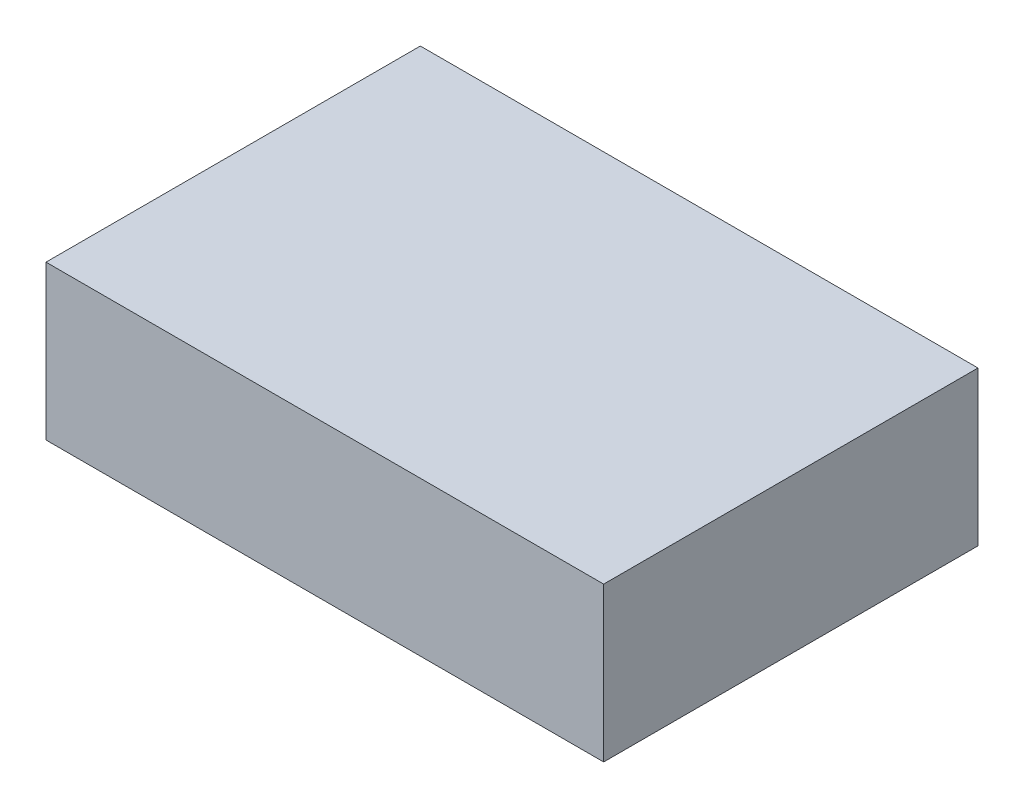
from build123d import *

# Parameters (mm, degrees)
SKETCH1_W           = 36.2
SKETCH1_H           = 24.3
BOSS_EXTRUDE1_DEPTH = 10


with BuildPart() as part:
    # Sketch1 → Boss-Extrude1 (new body)
    with BuildSketch(Plane(origin=(0, 0, 0), x_dir=(1, 0, 0), z_dir=(0, 1, 0))):
        Rectangle(SKETCH1_W, SKETCH1_H)
    extrude(amount=BOSS_EXTRUDE1_DEPTH)


solid = part.part
